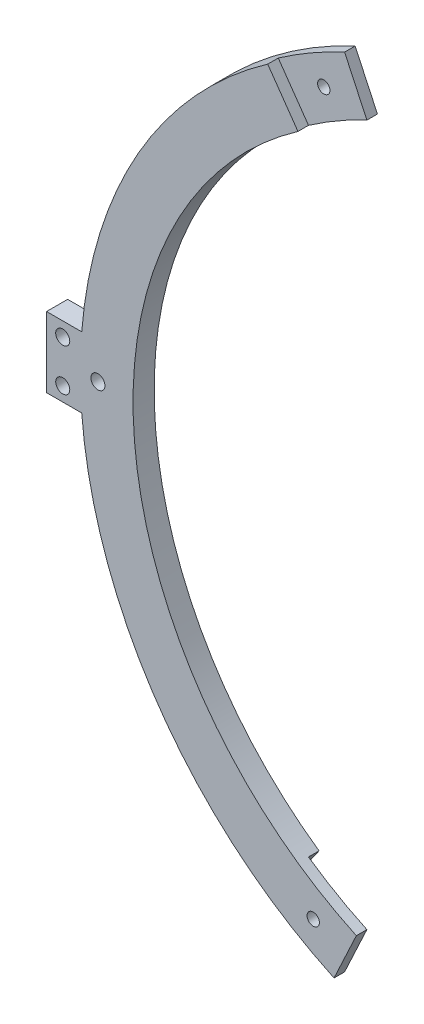
from build123d import *

# Parameters (mm, degrees)
ESQUISSE1_R             = 2
BOSS_EXTRU_1_DEPTH      = 6
ESQUISSE3_R             = 1.75
ENL_V_MAT_EXTRU_1_DEPTH = 10
ENL_V_START             = -3
ENL_V_MAT_EXTRU_2_DEPTH = 3
ENL_V_MAT_EXTRU_3_DEPTH = 3


with BuildPart() as part:
    # Esquisse1 → Boss.-Extru.1 (new body)
    with BuildSketch(Plane.XY):
        with BuildLine():
            Line((-134.599357944, -10), (-124.599357944, -10))
            ThreePointArc((-124.599357944, -10), (-102.650769054, -71.328953537), (-52.827282718, -113.28847338))
            Line((-52.827282718, -113.28847338), (-46.488008791, -99.693856574))
            ThreePointArc((-46.488008791, -99.693856574), (-110, 0), (-46.488008791, 99.693856574))
            Line((-46.488008791, 99.693856574), (-52.827282718, 113.28847338))
            ThreePointArc((-52.827282718, 113.28847338), (-102.650769054, 71.328953537), (-124.599357944, 10))
            Line((-124.599357944, 10), (-134.599357944, 10))
            Line((-134.599357944, 10), (-134.599357944, -10))
        make_face()
        with Locations((-120, 0)):
            Circle(ESQUISSE1_R, mode=Mode.SUBTRACT)
        with Locations((-130, 6)):
            Circle(ESQUISSE1_R, mode=Mode.SUBTRACT)
        with Locations((-130, -6)):
            Circle(ESQUISSE1_R, mode=Mode.SUBTRACT)
    extrude(amount=BOSS_EXTRU_1_DEPTH)

    # Esquisse3 → Enlèv. mat.-Extru.1 (cut)
    with BuildSketch(Plane.XY.offset(6)):
        with Locations((-58.75, 101.757984945)):
            Circle(ESQUISSE3_R)
        with Locations((-58.75, -101.757984945)):
            Circle(ESQUISSE3_R)
    extrude(amount=-ENL_V_MAT_EXTRU_1_DEPTH, mode=Mode.SUBTRACT)

    # Esquisse4 → Enlèv. mat.-Extru.2 (cut)
    with BuildSketch(Plane.XY.offset(6).offset(ENL_V_START)):
        with BuildLine():
            Line((-71.697054544, 102.394005536), (-63.093407999, 90.106724872))
            ThreePointArc((-63.093407999, 90.106724872), (-55, 95.262794416), (-46.488008791, 99.693856574))
            Line((-46.488008791, 99.693856574), (-52.827282718, 113.28847338))
            ThreePointArc((-52.827282718, 113.28847338), (-62.5, 108.253175473), (-71.697054544, 102.394005536))
        make_face()
    extrude(amount=ENL_V_MAT_EXTRU_2_DEPTH, mode=Mode.SUBTRACT)

    # Esquisse6 → Enlèv. mat.-Extru.3 (cut)
    with BuildSketch(Plane(origin=(0, 0, 0), x_dir=(-1, 0, 0), z_dir=(0, 0, -1))):
        with BuildLine():
            Line((63.093407999, -90.106724872), (71.697054544, -102.394005536))
            ThreePointArc((71.697054544, -102.394005536), (62.5, -108.253175473), (52.827282718, -113.28847338))
            Line((52.827282718, -113.28847338), (46.488008791, -99.693856574))
            ThreePointArc((46.488008791, -99.693856574), (55, -95.262794416), (63.093407999, -90.106724872))
        make_face()
    extrude(amount=-ENL_V_MAT_EXTRU_3_DEPTH, mode=Mode.SUBTRACT)


solid = part.part
